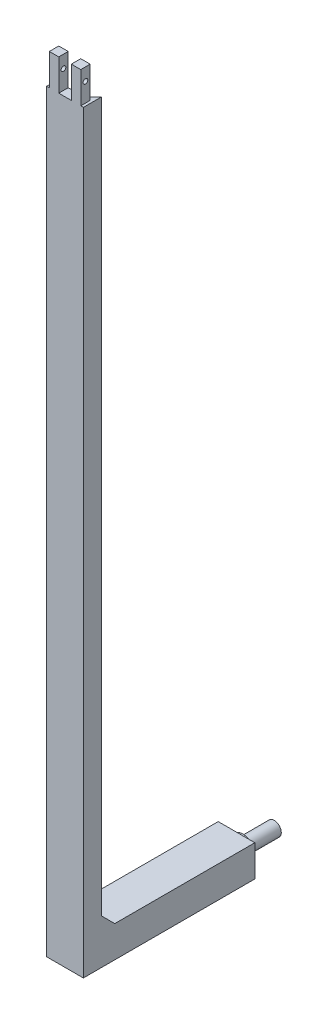
from build123d import *

# Parameters (mm, degrees)
SKETCH2_W           = 6
SKETCH2_H           = 240
BOSS_EXTRUDE1_DEPTH = 3
BOSS_EXTRUDE2_DEPTH = 240
SKETCH5_W           = 3
SKETCH5_H           = 3
BOSS_EXTRUDE3_DEPTH = 10
SKETCH6_R           = 0.75
CUT_EXTRUDE1_DEPTH  = 40
SKETCH7_W           = 11.65685425
SKETCH7_H           = 10
BOSS_EXTRUDE4_DEPTH = 51.58
SKETCH8_R           = 2.25
BOSS_EXTRUDE5_DEPTH = 12
BOSS_EXTRUDE6_DEPTH = 11.656857
SKETCH10_R          = 3.5
BOSS_EXTRUDE7_DEPTH = 2


with BuildPart() as part:
    # Sketch2 → Boss-Extrude1 (new body)
    with BuildSketch(Plane.XY):
        with Locations((-3, -120)):
            Rectangle(SKETCH2_W, SKETCH2_H)
    extrude(amount=BOSS_EXTRUDE1_DEPTH)

    # Sketch4 → Boss-Extrude2 (add)
    with BuildSketch(Plane(origin=(0, -240, 0), x_dir=(-1, 0, 0), z_dir=(0, -1, 0))):
        Polygon((0, 0), (-2.828427125, 2.828427125), (-2.828427125, -3), (0, -3), align=None)
        Polygon((8.828427125, -3), (6, -3), (6, 0), (8.828427125, 2.828427125), align=None)
    extrude(amount=-BOSS_EXTRUDE2_DEPTH)

    # Sketch5 → Boss-Extrude3 (add)
    with BuildSketch(Plane(origin=(0, 0, 0), x_dir=(1, 0, 0), z_dir=(0, 1, 0))):
        with Locations((-6.5, -1.5)):
            Rectangle(SKETCH5_W, SKETCH5_H)
        with Locations((0.5, -1.5)):
            Rectangle(SKETCH5_W, SKETCH5_H)
    extrude(amount=BOSS_EXTRUDE3_DEPTH)

    # Sketch6 → Cut-Extrude1 (cut)
    with BuildSketch(Plane(origin=(2, 0, 0), x_dir=(0, 0, -1), z_dir=(1, 0, 0))):
        with Locations((-1.5, 6)):
            Circle(SKETCH6_R)
    extrude(amount=-CUT_EXTRUDE1_DEPTH, mode=Mode.SUBTRACT)

    # Sketch7 → Boss-Extrude4 (add)
    with BuildSketch(Plane(origin=(0, 0, 0), x_dir=(-1, 0, 0), z_dir=(0, 0, -1))):
        with Locations((3, -235)):
            Rectangle(SKETCH7_W, SKETCH7_H)
    extrude(amount=BOSS_EXTRUDE4_DEPTH)

    # Sketch8 → Boss-Extrude5 (add)
    with BuildSketch(Plane(origin=(0, 0, -51.58), x_dir=(-1, 0, 0), z_dir=(0, 0, -1))):
        with Locations((3, -235)):
            Circle(SKETCH8_R)
    extrude(amount=BOSS_EXTRUDE5_DEPTH)

    # Sketch9 → Boss-Extrude6 (add)
    with BuildSketch(Plane.ZY.offset(8.828427125)):
        Polygon((-7, -230), (0, -230), (0, -223), align=None)
    extrude(amount=-BOSS_EXTRUDE6_DEPTH)

    # Sketch10 → Boss-Extrude7 (add)
    with BuildSketch(Plane(origin=(0, 0, -51.58), x_dir=(-1, 0, 0), z_dir=(0, 0, -1))):
        with Locations((3, -235)):
            Circle(SKETCH10_R)
    extrude(amount=BOSS_EXTRUDE7_DEPTH)


solid = part.part
